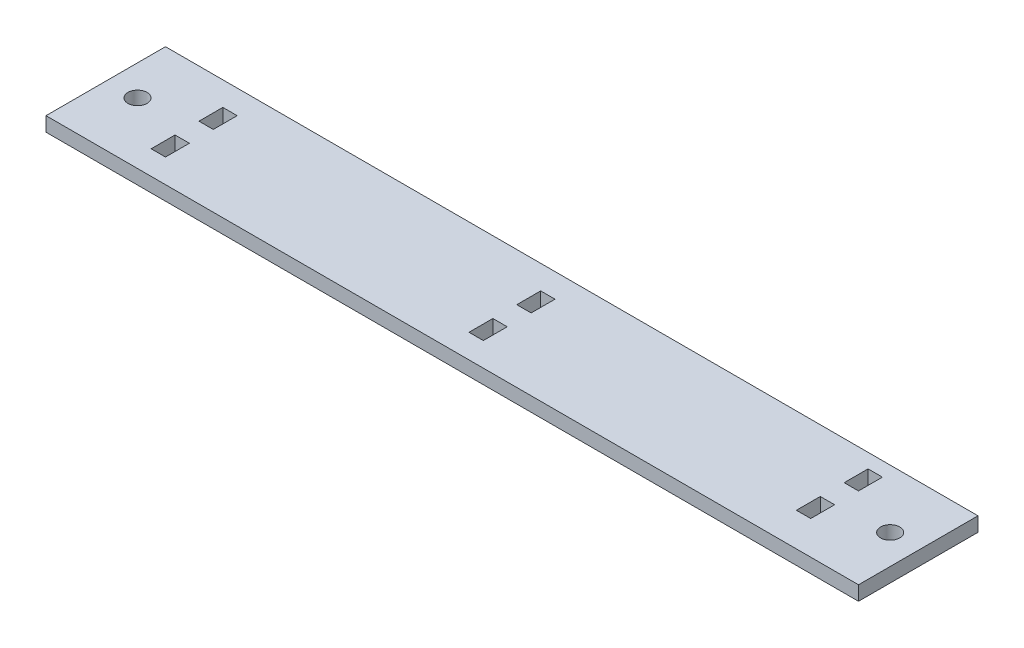
from build123d import *

# Parameters (mm, degrees)
SKICA1_W                 = 170
SKICA1_H                 = 25
P_IDAT_VYSUNUT_M1_DEPTH  = 3
SKICA2_W                 = 3
SKICA2_H                 = 5
ODEBRAT_VYSUNUT_M2_DEPTH = 86.966563267
SKICA3_R                 = 2
ODEBRAT_VYSUNUT_M3_DEPTH = 86.966563267


with BuildPart() as part:
    # Skica1 → Přidat vysunutím1 (new body)
    with BuildSketch(Plane(origin=(0, 0, 0), x_dir=(1, 0, 0), z_dir=(0, 1, 0))):
        Rectangle(SKICA1_W, SKICA1_H)
    extrude(amount=P_IDAT_VYSUNUT_M1_DEPTH)

    # Skica2 → Odebrat vysunutím2 (cut, through all)
    with BuildSketch(Plane(origin=(0, 0, 0), x_dir=(1, 0, 0), z_dir=(0, 1, 0))):
        with Locations((0, 5)):
            Rectangle(SKICA2_W, SKICA2_H)
        with Locations((0, -5)):
            Rectangle(SKICA2_W, SKICA2_H)
        with Locations((-66.5, 5)):
            Rectangle(SKICA2_W, SKICA2_H)
        with Locations((-66.5, -5)):
            Rectangle(SKICA2_W, SKICA2_H)
        with Locations((66.5, 7)):
            Rectangle(SKICA2_W, SKICA2_H)
        with Locations((66.5, -3)):
            Rectangle(SKICA2_W, SKICA2_H)
    extrude(amount=ODEBRAT_VYSUNUT_M2_DEPTH, mode=Mode.SUBTRACT)

    # Skica3 → Odebrat vysunutím3 (cut, through all)
    with BuildSketch(Plane(origin=(0, 0, 0), x_dir=(1, 0, 0), z_dir=(0, 1, 0))):
        with Locations(Location((-78.65, 0.29, 0), (0, 0, 270))):
            Circle(SKICA3_R)
        with Locations(Location((78.83, 0.29, 0), (0, 0, 270))):
            Circle(SKICA3_R)
    extrude(amount=ODEBRAT_VYSUNUT_M3_DEPTH, mode=Mode.SUBTRACT)


solid = part.part
